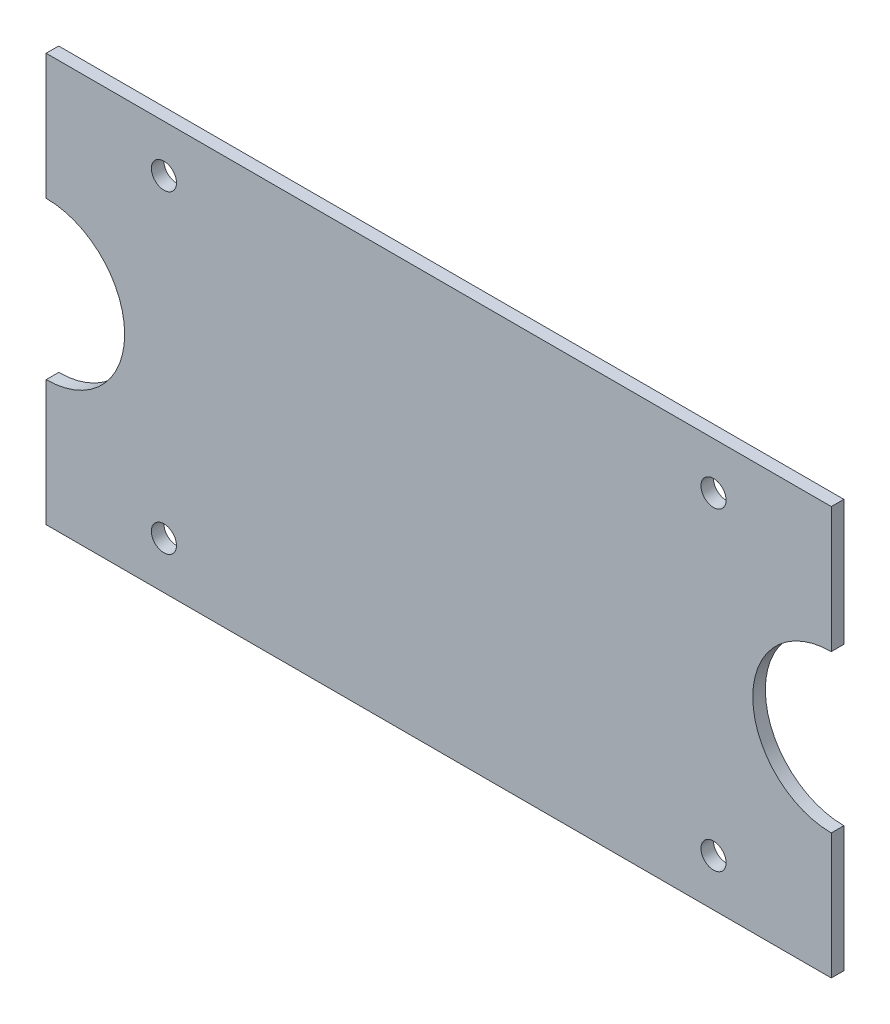
from build123d import *

# Parameters (mm, degrees)
ESQUISSE1_W             = 100
ESQUISSE1_H             = 52
ESQUISSE1_R             = 1.6
BOSS_EXTRU_1_DEPTH      = 1.6
ESQUISSE2_R             = 10
ENL_V_MAT_EXTRU_1_DEPTH = 113.723378232


with BuildPart() as part:
    # Esquisse1 → Boss.-Extru.1 (new body)
    with BuildSketch(Plane.XY):
        with Locations((50, 26)):
            Rectangle(ESQUISSE1_W, ESQUISSE1_H)
        with Locations((15, 46)):
            Circle(ESQUISSE1_R, mode=Mode.SUBTRACT)
        with Locations((85, 46)):
            Circle(ESQUISSE1_R, mode=Mode.SUBTRACT)
        with Locations((15, 6)):
            Circle(ESQUISSE1_R, mode=Mode.SUBTRACT)
        with Locations((85, 6)):
            Circle(ESQUISSE1_R, mode=Mode.SUBTRACT)
    extrude(amount=BOSS_EXTRU_1_DEPTH)

    # Esquisse2 → Enlèv. mat.-Extru.1 (cut, through all)
    with BuildSketch(Plane(origin=(0, 0, 0), x_dir=(-1, 0, 0), z_dir=(0, 0, -1))):
        with Locations((-100, 26)):
            Circle(ESQUISSE2_R)
        with Locations((0, 26)):
            Circle(ESQUISSE2_R)
    extrude(amount=-ENL_V_MAT_EXTRU_1_DEPTH, mode=Mode.SUBTRACT)


solid = part.part
